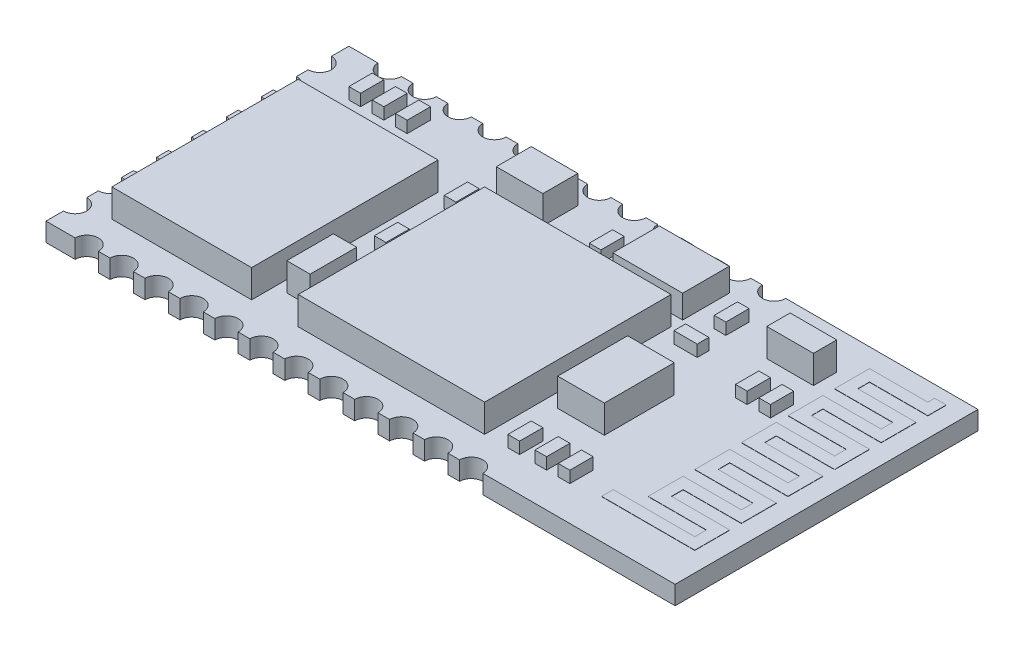
from build123d import *

# Parameters (mm, degrees)
SKETCH1_W           = 27
SKETCH1_H           = 13
BOSS_EXTRUDE1_DEPTH = 0.8
SKETCH2_R           = 0.5
CUT_EXTRUDE7_DEPTH  = 2
SKETCH9_R           = 0.5
CUT_EXTRUDE9_DEPTH  = 2
SKETCH10_W          = 6
SKETCH10_H          = 8
SKETCH10_W_2        = 8
BOSS_EXTRUDE2_DEPTH = 1.2
SKETCH12_W          = 3
SKETCH12_H          = 2
BOSS_EXTRUDE3_DEPTH = 1
SKETCH13_W          = 2
SKETCH13_H          = 1.5
BOSS_EXTRUDE4_DEPTH = 1.2
SKETCH14_W          = 0.5
SKETCH14_H          = 1
SKETCH14_W_2        = 1
SKETCH14_H_2        = 0.5
BOSS_EXTRUDE6_DEPTH = 0.5
SKETCH15_W          = 2
SKETCH15_H          = 1
SKETCH15_W_2        = 1
SKETCH15_H_2        = 2
BOSS_EXTRUDE7_DEPTH = 1.2
SKETCH16_W          = 2
SKETCH16_H          = 3
BOSS_EXTRUDE8_DEPTH = 1.2
BOSS_EXTRUDE9_DEPTH = 0.01


with BuildPart() as part:
    # Sketch1 → Boss-Extrude1 (new body)
    with BuildSketch(Plane(origin=(0, 0, 0), x_dir=(1, 0, 0), z_dir=(0, 1, 0))):
        Rectangle(SKETCH1_W, SKETCH1_H)
    extrude(amount=BOSS_EXTRUDE1_DEPTH)

    # Sketch2 → Cut-Extrude7 (cut)
    with BuildSketch(Plane(origin=(0, 0.8, 0), x_dir=(1, 0, 0), z_dir=(0, 1, 0))):
        with Locations((-13.5, 5.25)):
            Circle(SKETCH2_R)
        with Locations((-13.5, 3.75)):
            Circle(SKETCH2_R)
        with Locations((-13.5, 2.25)):
            Circle(SKETCH2_R)
        with Locations((-13.5, 0.75)):
            Circle(SKETCH2_R)
        with Locations((-13.5, -0.75)):
            Circle(SKETCH2_R)
        with Locations((-13.5, -2.25)):
            Circle(SKETCH2_R)
        with Locations((-13.5, -3.75)):
            Circle(SKETCH2_R)
        with Locations((-13.5, -5.25)):
            Circle(SKETCH2_R)
    extrude(amount=-CUT_EXTRUDE7_DEPTH, mode=Mode.SUBTRACT)

    # Sketch9 → Cut-Extrude9 (cut)
    with BuildSketch(Plane(origin=(0, 0.8, 0), x_dir=(1, 0, 0), z_dir=(0, 1, 0))):
        with Locations((-11.75, 6.5)):
            Circle(SKETCH9_R)
        with Locations((-10.25, 6.5)):
            Circle(SKETCH9_R)
        with Locations((-8.75, 6.5)):
            Circle(SKETCH9_R)
        with Locations((-7.25, 6.5)):
            Circle(SKETCH9_R)
        with Locations((-5.75, 6.5)):
            Circle(SKETCH9_R)
        with Locations((-4.25, 6.5)):
            Circle(SKETCH9_R)
        with Locations((-2.75, 6.5)):
            Circle(SKETCH9_R)
        with Locations((-1.25, 6.5)):
            Circle(SKETCH9_R)
        with Locations((0.25, 6.5)):
            Circle(SKETCH9_R)
        with Locations((1.75, 6.5)):
            Circle(SKETCH9_R)
        with Locations((3.25, 6.5)):
            Circle(SKETCH9_R)
        with Locations((4.75, 6.5)):
            Circle(SKETCH9_R)
        with Locations((4.75, -6.5)):
            Circle(SKETCH9_R)
        with Locations((3.25, -6.5)):
            Circle(SKETCH9_R)
        with Locations((1.75, -6.5)):
            Circle(SKETCH9_R)
        with Locations((0.25, -6.5)):
            Circle(SKETCH9_R)
        with Locations((-1.25, -6.5)):
            Circle(SKETCH9_R)
        with Locations((-2.75, -6.5)):
            Circle(SKETCH9_R)
        with Locations((-4.25, -6.5)):
            Circle(SKETCH9_R)
        with Locations((-5.75, -6.5)):
            Circle(SKETCH9_R)
        with Locations((-7.25, -6.5)):
            Circle(SKETCH9_R)
        with Locations((-8.75, -6.5)):
            Circle(SKETCH9_R)
        with Locations((-10.25, -6.5)):
            Circle(SKETCH9_R)
        with Locations((-11.75, -6.5)):
            Circle(SKETCH9_R)
    extrude(amount=-CUT_EXTRUDE9_DEPTH, mode=Mode.SUBTRACT)

    # Sketch10 → Boss-Extrude2 (add)
    with BuildSketch(Plane(origin=(0, 0.8, 0), x_dir=(1, 0, 0), z_dir=(0, 1, 0))):
        with Locations((-9.158592774, -1.016549072)):
            Rectangle(SKETCH10_W, SKETCH10_H)
        with Locations((-0.158592774, -1.016549072)):
            Rectangle(SKETCH10_W_2, SKETCH10_H)
    extrude(amount=BOSS_EXTRUDE2_DEPTH)

    # Sketch12 → Boss-Extrude3 (add)
    with BuildSketch(Plane(origin=(0, 0.8, 0), x_dir=(1, 0, 0), z_dir=(0, 1, 0))):
        with Locations((2.341407226, 4.483450928)):
            Rectangle(SKETCH12_W, SKETCH12_H)
    extrude(amount=BOSS_EXTRUDE3_DEPTH)

    # Sketch13 → Boss-Extrude4 (add)
    with BuildSketch(Plane(origin=(0, 0.8, 0), x_dir=(1, 0, 0), z_dir=(0, 1, 0))):
        with Locations((-3.658592774, 4.733450928)):
            Rectangle(SKETCH13_W, SKETCH13_H)
    extrude(amount=BOSS_EXTRUDE4_DEPTH)

    # Sketch14 → Boss-Extrude6 (add)
    with BuildSketch(Plane(origin=(0, 0.8, 0), x_dir=(1, 0, 0), z_dir=(0, 1, 0))):
        with Locations((-9.25, 5)):
            Rectangle(SKETCH14_W, SKETCH14_H)
        with Locations((-5.158592774, 0)):
            Rectangle(SKETCH14_W, SKETCH14_H)
        with Locations((5.091407226, 4.336621963)):
            Rectangle(SKETCH14_W, SKETCH14_H)
        with Locations((8.116137584, 2.225585846)):
            Rectangle(SKETCH14_W, SKETCH14_H)
        with Locations((9.116137584, 2.225585846)):
            Rectangle(SKETCH14_W, SKETCH14_H)
        with Locations((6.25, -4.516549072)):
            Rectangle(SKETCH14_W, SKETCH14_H)
        with Locations((-11.25, 5)):
            Rectangle(SKETCH14_W, SKETCH14_H)
        with Locations((-10.25, 5)):
            Rectangle(SKETCH14_W, SKETCH14_H)
        with Locations((-0.270236952, 4.336621963)):
            Rectangle(SKETCH14_W, SKETCH14_H)
        with Locations((-5.158592774, 3)):
            Rectangle(SKETCH14_W, SKETCH14_H)
        with Locations((5.045928456, 2.653097674)):
            Rectangle(SKETCH14_W_2, SKETCH14_H_2)
        with Locations((7.25, -4.516549072)):
            Rectangle(SKETCH14_W, SKETCH14_H)
        with Locations((5.091407226, -4.516549072)):
            Rectangle(SKETCH14_W, SKETCH14_H)
    extrude(amount=BOSS_EXTRUDE6_DEPTH)

    # Sketch15 → Boss-Extrude7 (add)
    with BuildSketch(Plane(origin=(0, 0.8, 0), x_dir=(1, 0, 0), z_dir=(0, 1, 0))):
        with Locations((8.084421652, 4.353233129)):
            Rectangle(SKETCH15_W, SKETCH15_H)
        with Locations((-5.160364115, -3.004825478)):
            Rectangle(SKETCH15_W_2, SKETCH15_H_2)
    extrude(amount=BOSS_EXTRUDE7_DEPTH)

    # Sketch16 → Boss-Extrude8 (add)
    with BuildSketch(Plane(origin=(0, 0.8, 0), x_dir=(1, 0, 0), z_dir=(0, 1, 0))):
        with Locations((5.444247196, -0.981381649)):
            Rectangle(SKETCH16_W, SKETCH16_H)
    extrude(amount=BOSS_EXTRUDE8_DEPTH)

    # Sketch17 → Boss-Extrude9 (add)
    with BuildSketch(Plane(origin=(0, 0.8, 0), x_dir=(1, 0, 0), z_dir=(0, 1, 0))):
        Polygon((12.163913607, 5.68064174), (9.663913607, 5.68064174), (9.663913607, 4.18064174), (12.163913607, 4.18064174), (12.163913607, 3.68064174), (9.663913607, 3.68064174), (9.663913607, 2.18064174), (12.163913607, 2.18064174), (12.163913607, 1.68064174), (9.663913607, 1.68064174), (9.663913607, 0.18064174), (12.163913607, 0.18064174), (12.163913607, -0.31935826), (9.663913607, -0.31935826), (9.663913607, -1.81935826), (12.163913607, -1.81935826), (12.163913607, -2.31935826), (9.663913607, -2.31935826), (9.663913607, -3.81935826), (12.163913607, -3.81935826), (12.163913607, -4.31935826), (8.663913607, -4.31935826), (8.663913607, -4.81935826), (12.663913607, -4.81935826), (12.663913607, -3.31935826), (10.163913607, -3.31935826), (10.163913607, -2.81935826), (12.663913607, -2.81935826), (12.663913607, -1.31935826), (10.163913607, -1.31935826), (10.163913607, -0.81935826), (12.663913607, -0.81935826), (12.663913607, 0.68064174), (10.163913607, 0.68064174), (10.163913607, 1.18064174), (12.663913607, 1.18064174), (12.663913607, 2.68064174), (10.163913607, 2.68064174), (10.163913607, 3.18064174), (12.663913607, 3.18064174), (12.663913607, 4.68064174), (10.163913607, 4.68064174), (10.163913607, 5.18064174), (12.663913607, 5.18064174), (12.663913607, 5.975044168), (12.163913607, 5.975044168), align=None)
    extrude(amount=BOSS_EXTRUDE9_DEPTH)


solid = part.part
